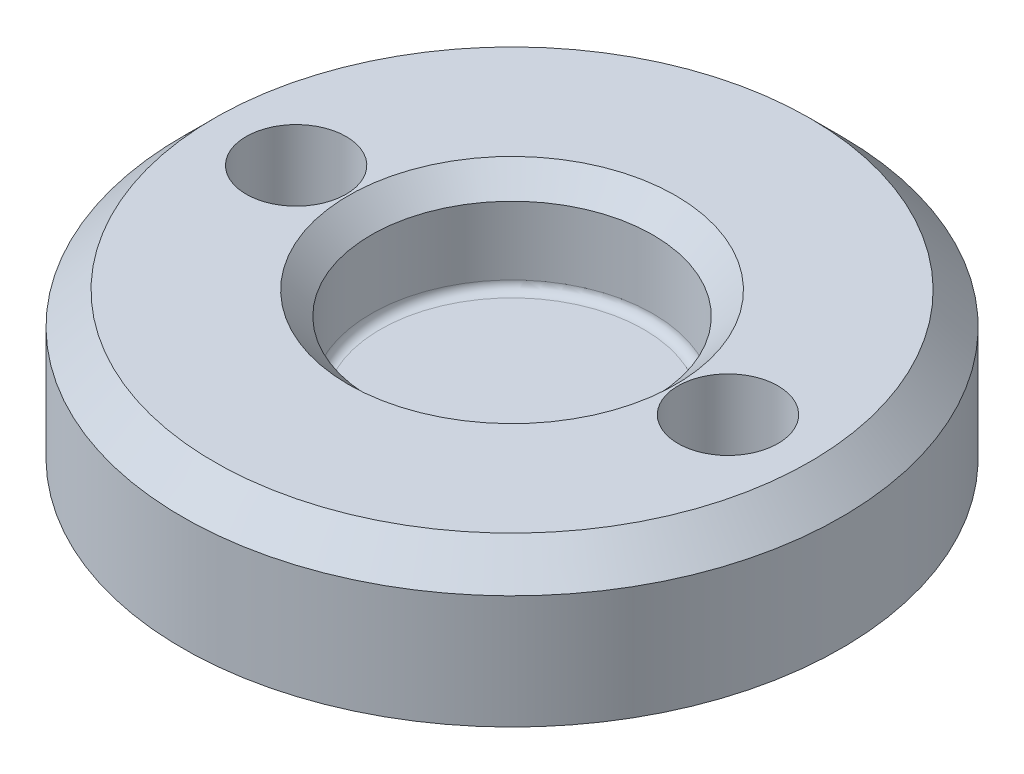
from build123d import *

# Parameters (mm, degrees)
CHAMFER2_SIZE     = 0.5
CIRPATTERN1_COUNT = 2
CHAMFER3_SIZE     = 0.7
FILLET2_R         = 0.2


with BuildPart() as part:
    # Sketch1 → Revolve1 (revolve)
    with BuildSketch(Plane.XY, mode=Mode.PRIVATE) as revolve1_sk:
        Polygon((0, 0), (-7.25, 0), (-7.25, 3.2), (-3.1, 3.2), (-3.1, 1), (0, 1), align=None)
    revolve(revolve1_sk.sketch.rotate(Axis((0, 0, 0), (0, 1, 0)), 270), axis=Axis((0, 0, 0), (0, 1, 0)))

    # Chamfer2
    chamfer2_edges = [part.edges().sort_by_distance(p)[0] for p in [
        (0, 3.2, 3.1),
    ]]
    chamfer(chamfer2_edges, length=CHAMFER2_SIZE)

    # Sketch4 → CSK for M2 Flat Head Machine Screw1 (revolve, cut)
    with BuildSketch(Plane(origin=(-4.75, 0, 0), x_dir=(0, 0, -1), z_dir=(1, 0, 0))):
        Polygon((0, 0), (0, 5.660946681), (1.1, 5), (1.1, 1.1), (2.2, 0), align=None)
    csk_for_m2_flat_head_machine_screw1 = revolve(axis=Axis((-4.75, -6.35, 0), (0, 1, 0)), mode=Mode.SUBTRACT)

    # CirPattern1: CSK for M2 Flat Head Machine Screw1 ×2 about axis
    cirpattern1_axis = Axis((0, 0, 0), (0, 1, 0))
    for i in range(1, CIRPATTERN1_COUNT):
        add(csk_for_m2_flat_head_machine_screw1.rotate(cirpattern1_axis, i * 360 / CIRPATTERN1_COUNT), mode=Mode.SUBTRACT)

    # Chamfer3
    chamfer3_edges = [part.edges().sort_by_distance(p)[0] for p in [
        (0, 3.2, 7.25),
    ]]
    chamfer(chamfer3_edges, length=CHAMFER3_SIZE)

    # Fillet2
    fillet2_edges = [part.edges().sort_by_distance(p)[0] for p in [
        (0, 1, 3.1),
    ]]
    fillet(fillet2_edges, radius=FILLET2_R)


solid = part.part
